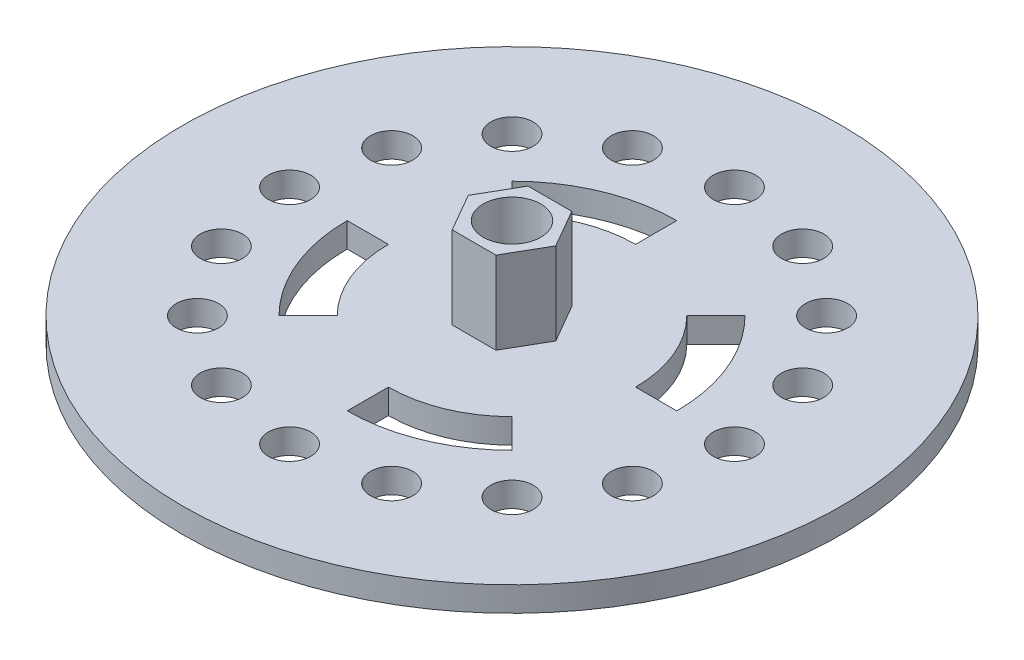
from build123d import *

# Parameters (mm, degrees)
SKETCH1_R           = 50.8
BOSS_EXTRUDE1_DEPTH = 3.81
CUT_EXTRUDE1_DEPTH  = 72.943005914
SKETCH3_R           = 3.2639
CUT_EXTRUDE2_DEPTH  = 72.943005914
SKETCH4_R           = 4.445
BOSS_EXTRUDE2_DEPTH = 12.7


with BuildPart() as part:
    # Sketch1 → Boss-Extrude1 (new body)
    with BuildSketch(Plane(origin=(0, 0, 0), x_dir=(1, 0, 0), z_dir=(0, 1, 0))):
        with Locations(Location((0, 0, 0), (0, 0, 90))):
            Circle(SKETCH1_R)
    extrude(amount=BOSS_EXTRUDE1_DEPTH)

    # Sketch2 → Cut-Extrude1 (cut, through all)
    with BuildSketch(Plane(origin=(0, 3.81, 0), x_dir=(1, 0, 0), z_dir=(0, 1, 0))):
        with BuildLine():
            ThreePointArc((-13.470384182, 13.470384182), (-7.290119387, 17.599905094), (0, 19.05))
            Line((0, 19.05), (0, 25.4))
            ThreePointArc((0, 25.4), (-9.720159182, 23.466540126), (-17.960512242, 17.960512242))
            Line((-17.960512242, 17.960512242), (-13.470384182, 13.470384182))
        make_face()
        with BuildLine():
            Line((-17.960512242, -17.960512242), (-13.470384182, -13.470384182))
            ThreePointArc((-13.470384182, -13.470384182), (-17.599905094, -7.290119387), (-19.05, 0))
            Line((-19.05, 0), (-25.4, 0))
            ThreePointArc((-25.4, 0), (-23.466540126, -9.720159182), (-17.960512242, -17.960512242))
        make_face()
        with BuildLine():
            Line((17.960512242, -17.960512242), (13.470384182, -13.470384182))
            ThreePointArc((13.470384182, -13.470384182), (7.290119387, -17.599905094), (0, -19.05))
            Line((0, -19.05), (0, -25.4))
            ThreePointArc((0, -25.4), (9.720159182, -23.466540126), (17.960512242, -17.960512242))
        make_face()
        with BuildLine():
            Line((17.960512242, 17.960512242), (13.470384182, 13.470384182))
            ThreePointArc((13.470384182, 13.470384182), (17.599905094, 7.290119387), (19.05, 0))
            Line((19.05, 0), (25.4, 0))
            ThreePointArc((25.4, 0), (23.466540126, 9.720159182), (17.960512242, 17.960512242))
        make_face()
    extrude(amount=-CUT_EXTRUDE1_DEPTH, mode=Mode.SUBTRACT)

    # Sketch3 → Cut-Extrude2 (cut, through all)
    with BuildSketch(Plane(origin=(0, 3.81, 0), x_dir=(1, 0, 0), z_dir=(0, 1, 0))):
        with Locations(Location((13.122214896, 31.67982917, 0), (0, 0, 270))):
            Circle(SKETCH3_R)
        with Locations(Location((24.246691527, 24.246691527, 0), (0, 0, 270))):
            Circle(SKETCH3_R)
        with Locations(Location((31.67982917, 13.122214896, 0), (0, 0, 270))):
            Circle(SKETCH3_R)
        with Locations(Location((31.67982917, -13.122214896, 0), (0, 0, 270))):
            Circle(SKETCH3_R)
        with Locations(Location((24.246691527, -24.246691527, 0), (0, 0, 270))):
            Circle(SKETCH3_R)
        with Locations(Location((13.122214896, -31.67982917, 0), (0, 0, 270))):
            Circle(SKETCH3_R)
        with Locations(Location((0, -34.29, 0), (0, 0, 270))):
            Circle(SKETCH3_R)
        with Locations(Location((-13.122214896, -31.67982917, 0), (0, 0, 270))):
            Circle(SKETCH3_R)
        with Locations(Location((-24.246691527, -24.246691527, 0), (0, 0, 270))):
            Circle(SKETCH3_R)
        with Locations(Location((-31.67982917, -13.122214896, 0), (0, 0, 270))):
            Circle(SKETCH3_R)
        with Locations(Location((-34.29, 0, 0), (0, 0, 270))):
            Circle(SKETCH3_R)
        with Locations(Location((-31.67982917, 13.122214896, 0), (0, 0, 270))):
            Circle(SKETCH3_R)
        with Locations(Location((-24.246691527, 24.246691527, 0), (0, 0, 270))):
            Circle(SKETCH3_R)
        with Locations(Location((-13.122214896, 31.67982917, 0), (0, 0, 270))):
            Circle(SKETCH3_R)
        with Locations(Location((0, 34.29, 0), (0, 0, 270))):
            Circle(SKETCH3_R)
        with Locations(Location((34.29, 0, 0), (0, 0, 270))):
            Circle(SKETCH3_R)
    extrude(amount=-CUT_EXTRUDE2_DEPTH, mode=Mode.SUBTRACT)

    # Sketch4 → Boss-Extrude2 (add)
    with BuildSketch(Plane(origin=(0, 3.81, 0), x_dir=(1, 0, 0), z_dir=(0, 1, 0))):
        Polygon((-6.745760545, 0), (-3.372880273, 5.842), (3.372880273, 5.842), (6.745760545, 0), (3.372880273, -5.842), (-3.372880273, -5.842), align=None)
        with Locations(Location((0, 0, 0), (0, 0, 270))):
            Circle(SKETCH4_R, mode=Mode.SUBTRACT)
    extrude(amount=BOSS_EXTRUDE2_DEPTH)


solid = part.part
